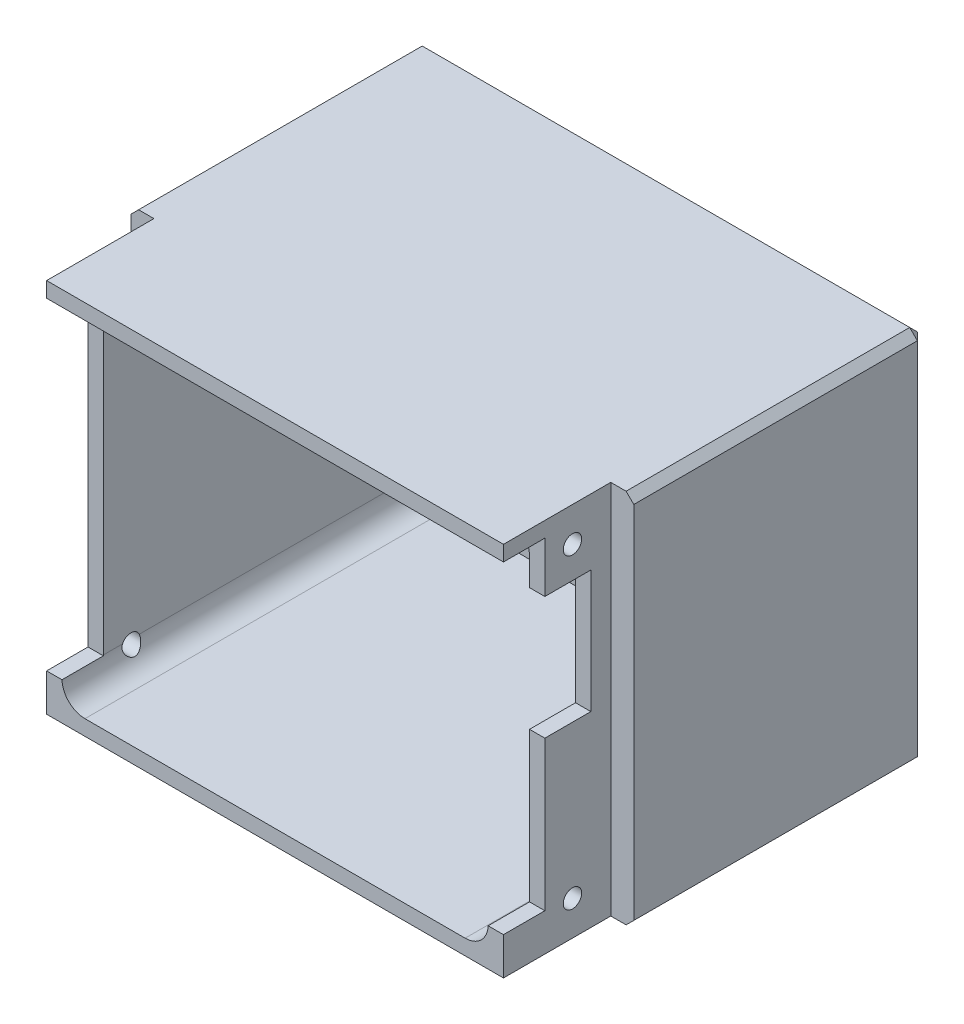
from build123d import *

# Parameters (mm, degrees)
SKETCH7_W           = 32.8
SKETCH7_H           = 24.5
BOSS_EXTRUDE3_DEPTH = 19
SKETCH8_W           = 29.8
SKETCH8_H           = 24.5
BOSS_EXTRUDE4_DEPTH = 7
CUT_EXTRUDE1_DEPTH  = 23.5
CUT_EXTRUDE2_REACH  = 44.494
SKETCH10_W          = 2.7
SKETCH10_H          = 21.05
SKETCH18_W          = 3
SKETCH18_H          = 8
CUT_EXTRUDE3_DEPTH  = 1
CHAMFER1_SIZE       = 0.5
CUT_EXTRUDE5_REACH  = 44.494
SKETCH20_R          = 0.6
CUT_EXTRUDE6_REACH  = 44.494
SKETCH19_R          = 0.6
CUT_EXTRUDE7_REACH  = 35.091
SKETCH21_R          = 2.25
SKETCH21_R_2        = 1.25
CHAMFER2_SIZE       = 0.5
CHAMFER4_SIZE       = 0.2


with BuildPart() as part:
    # Sketch7 → Boss-Extrude3 (new body)
    with BuildSketch(Plane.XY):
        Rectangle(SKETCH7_W, SKETCH7_H)
    extrude(amount=BOSS_EXTRUDE3_DEPTH)

    # Sketch8 → Boss-Extrude4 (add)
    with BuildSketch(Plane.XY.offset(19)):
        Rectangle(SKETCH8_W, SKETCH8_H)
    extrude(amount=BOSS_EXTRUDE4_DEPTH)

    # Sketch16 → Cut-Extrude1 (cut)
    with BuildSketch(Plane.XY.offset(26)):
        with BuildLine():
            Line((-12.4, -11.25), (12.4, -11.25))
            ThreePointArc((12.4, -11.25), (13.460660172, -10.810660172), (13.9, -9.75))
            Line((13.9, -9.75), (13.9, 9.75))
            ThreePointArc((13.9, 9.75), (13.460660172, 10.810660172), (12.4, 11.25))
            Line((12.4, 11.25), (-12.4, 11.25))
            ThreePointArc((-12.4, 11.25), (-13.460660172, 10.810660172), (-13.9, 9.75))
            Line((-13.9, 9.75), (-13.9, -9.75))
            ThreePointArc((-13.9, -9.75), (-13.460660172, -10.810660172), (-12.4, -11.25))
        make_face()
    extrude(amount=-CUT_EXTRUDE1_DEPTH, mode=Mode.SUBTRACT)

    # Cut-Extrude2: up to this face of the body (flat: up to its plane)
    cut_extrude2_end = Plane(part.part.faces().sort_by_distance((14.9, 0, 22.5))[0])
    # Sketch10 → Cut-Extrude2 (cut, up to the picked face)
    with BuildSketch(Plane.ZY.offset(14.9), mode=Mode.PRIVATE) as cut_extrude2_sk1:
        with Locations((24.65, 0.725)):
            Rectangle(SKETCH10_W, SKETCH10_H)
    cut_extrude2_tool1 = split(extrude(cut_extrude2_sk1.sketch, amount=-CUT_EXTRUDE2_REACH, mode=Mode.PRIVATE), bisect_by=cut_extrude2_end, keep=Keep.BOTH, mode=Mode.PRIVATE)
    add(cut_extrude2_tool1.solids().sort_by(Axis((-14.9, 0.725, 24.65), (1, 0, 0)))[0], mode=Mode.SUBTRACT)

    # Sketch18 → Cut-Extrude3 (cut)
    with BuildSketch(Plane(origin=(14.9, 0, 0), x_dir=(0, 0, -1), z_dir=(1, 0, 0))):
        with Locations((-21.8, 3.95)):
            Rectangle(SKETCH18_W, SKETCH18_H)
    extrude(amount=-CUT_EXTRUDE3_DEPTH, mode=Mode.SUBTRACT)

    # Chamfer1
    chamfer1_edges = [part.edges().sort_by_distance(p)[0] for p in [
        (0, -12.25, 0),
        (-16.4, 0, 0),
        (0, 12.25, 0),
        (16.4, 0, 0),
        (16.4, -12.25, 9.5),
        (-16.4, -12.25, 9.5),
        (-16.4, 12.25, 9.5),
        (16.4, 12.25, 9.5),
    ]]
    chamfer(chamfer1_edges, length=CHAMFER1_SIZE)

    # Sketch20 → Cut-Extrude5 (cut, up to next)
    with BuildSketch(Plane(origin=(14.9, 0, 0), x_dir=(0, 0, -1), z_dir=(1, 0, 0)), mode=Mode.PRIVATE) as cut_extrude5_sk1:
        with Locations((-21.5, 10)):
            Circle(SKETCH20_R)
    cut_extrude5_tool1 = extrude(cut_extrude5_sk1.sketch, amount=-CUT_EXTRUDE5_REACH, mode=Mode.PRIVATE) & part.part
    # Sketch20 → Cut-Extrude5 (cut, up to next)
    with BuildSketch(Plane(origin=(14.9, 0, 0), x_dir=(0, 0, -1), z_dir=(1, 0, 0)), mode=Mode.PRIVATE) as cut_extrude5_sk2:
        with Locations((-21.5, -10)):
            Circle(SKETCH20_R)
    cut_extrude5_tool2 = extrude(cut_extrude5_sk2.sketch, amount=-CUT_EXTRUDE5_REACH, mode=Mode.PRIVATE) & part.part
    add(cut_extrude5_tool1.solids().sort_by_distance((14.9, 10, 21.5))[0], mode=Mode.SUBTRACT)
    add(cut_extrude5_tool2.solids().sort_by_distance((14.9, -10, 21.5))[0], mode=Mode.SUBTRACT)

    # Sketch19 → Cut-Extrude6 (cut, up to next)
    with BuildSketch(Plane.ZY.offset(14.9), mode=Mode.PRIVATE) as cut_extrude6_sk1:
        with Locations(Location((21.5, 10, 0), (0, 0, 180))):
            Circle(SKETCH19_R)
    cut_extrude6_tool1 = extrude(cut_extrude6_sk1.sketch, amount=-CUT_EXTRUDE6_REACH, mode=Mode.PRIVATE) & part.part
    # Sketch19 → Cut-Extrude6 (cut, up to next)
    with BuildSketch(Plane.ZY.offset(14.9), mode=Mode.PRIVATE) as cut_extrude6_sk2:
        with Locations(Location((21.5, -10, 0), (0, 0, 180))):
            Circle(SKETCH19_R)
    cut_extrude6_tool2 = extrude(cut_extrude6_sk2.sketch, amount=-CUT_EXTRUDE6_REACH, mode=Mode.PRIVATE) & part.part
    add(cut_extrude6_tool1.solids().sort_by_distance((-14.9, 10, 21.5))[0], mode=Mode.SUBTRACT)
    add(cut_extrude6_tool2.solids().sort_by_distance((-14.9, -10, 21.5))[0], mode=Mode.SUBTRACT)

    # Sketch21 → Cut-Extrude7 (cut, up to next)
    with BuildSketch(Plane(origin=(0, 0, 0), x_dir=(-1, 0, 0), z_dir=(0, 0, -1)), mode=Mode.PRIVATE) as cut_extrude7_sk1:
        with Locations((-10.65, 0)):
            Circle(SKETCH21_R)
    cut_extrude7_tool1 = extrude(cut_extrude7_sk1.sketch, amount=-CUT_EXTRUDE7_REACH, mode=Mode.PRIVATE) & part.part
    # Sketch21 → Cut-Extrude7 (cut, up to next)
    with BuildSketch(Plane(origin=(0, 0, 0), x_dir=(-1, 0, 0), z_dir=(0, 0, -1)), mode=Mode.PRIVATE) as cut_extrude7_sk2:
        with Locations((0, 6)):
            Circle(SKETCH21_R_2)
    cut_extrude7_tool2 = extrude(cut_extrude7_sk2.sketch, amount=-CUT_EXTRUDE7_REACH, mode=Mode.PRIVATE) & part.part
    # Sketch21 → Cut-Extrude7 (cut, up to next)
    with BuildSketch(Plane(origin=(0, 0, 0), x_dir=(-1, 0, 0), z_dir=(0, 0, -1)), mode=Mode.PRIVATE) as cut_extrude7_sk3:
        with Locations((0, -6)):
            Circle(SKETCH21_R_2)
    cut_extrude7_tool3 = extrude(cut_extrude7_sk3.sketch, amount=-CUT_EXTRUDE7_REACH, mode=Mode.PRIVATE) & part.part
    add(cut_extrude7_tool1.solids().sort_by_distance((10.65, 0, 0))[0], mode=Mode.SUBTRACT)
    add(cut_extrude7_tool2.solids().sort_by_distance((0, 6, 0))[0], mode=Mode.SUBTRACT)
    add(cut_extrude7_tool3.solids().sort_by_distance((0, -6, 0))[0], mode=Mode.SUBTRACT)

    # Chamfer2
    chamfer2_edges = [part.edges().sort_by_distance(p)[0] for p in [
        (12.9, 0, 0),
    ]]
    chamfer(chamfer2_edges, length=CHAMFER2_SIZE)

    # Chamfer4
    chamfer4_edges = [part.edges().sort_by_distance(p)[0] for p in [
        (1.25, 6, 2.5),
        (1.25, 6, 0),
        (1.25, -6, 2.5),
        (1.25, -6, 0),
        (12.9, 0, 2.5),
    ]]
    chamfer(chamfer4_edges, length=CHAMFER4_SIZE)


solid = part.part
